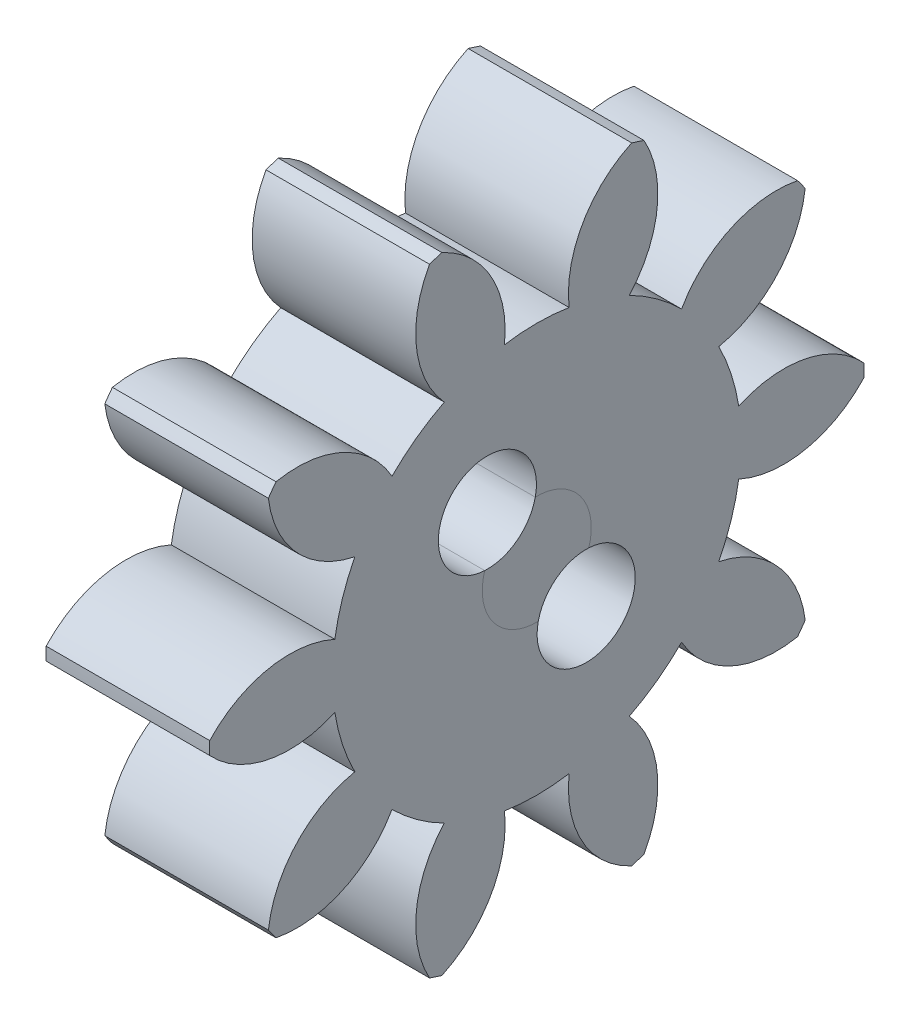
from build123d import *

# Parameters (mm, degrees)
BASPROSKE_W         = 3
BASPROSKE_H         = 6
TOOTHCUT_DEPTH      = 10
TEETHCUTS_COUNT     = 10
TEETHCUTS_ANGLE     = 324
HUBNEABOTSKE_R      = 0.5
HUBNEARBOTH_DEPTH   = 23.5000254
HUBFAR_START        = 23.5000254
HUBFARSKE_R         = 0.5
HUBFAR_DEPTH        = 23.5000254
BORSKE_R            = 1
BORE_DEPTH          = 50.0000508
SKETCH1_R           = 1
BOSS_EXTRUDE1_DEPTH = 3
SKETCH2_R           = 0.9
CUT_EXTRUDE1_DEPTH  = 3


with BuildPart() as part:
    # BasProSke → Base-Revolve (revolve)
    with BuildSketch(Plane(origin=(0, 0, 0), x_dir=(1, 0, 0), z_dir=(0, 1, 0))):
        with Locations((1.5, 3)):
            Rectangle(BASPROSKE_W, BASPROSKE_H)
    revolve(axis=Axis((-10, 0, 0), (1, 0, 0)))

    # TooCutSke → ToothCut (cut, through all)
    with BuildSketch(Plane(origin=(0, 0, 0), x_dir=(0, 0, -1), z_dir=(1, 0, 0))):
        with BuildLine():
            ThreePointArc((0.59278292, 3.701838653), (0, 3.749), (-0.59278292, 3.701838653))
            ThreePointArc((-0.59278292, 3.701838653), (-0.846593509, 4.924114224), (-1.775771316, 5.757784417))
            ThreePointArc((-1.775771316, 5.757784417), (0, 6.0254), (1.775771316, 5.757784417))
            ThreePointArc((1.775771316, 5.757784417), (0.846593509, 4.924114224), (0.59278292, 3.701838653))
        make_face()
    toothcut = extrude(amount=TOOTHCUT_DEPTH, mode=Mode.SUBTRACT)

    # TeethCuts: ToothCut ×10 about axis
    teethcuts_axis = Axis((-10, 0, 0), (1, 0, 0))
    for i in range(1, TEETHCUTS_COUNT):
        add(toothcut.rotate(teethcuts_axis, i * TEETHCUTS_ANGLE / (TEETHCUTS_COUNT - 1)), mode=Mode.SUBTRACT)

    # HubNeaBotSke → HubNearBoth (add)
    with BuildSketch(Plane.ZY):
        Circle(HUBNEABOTSKE_R)
    extrude(amount=HUBNEARBOTH_DEPTH)

    # HubFarSke → HubFar (add)
    with BuildSketch(Plane(origin=(3, 0, 0), x_dir=(0, 0, -1), z_dir=(1, 0, 0)).offset(HUBFAR_START)):
        Circle(HUBFARSKE_R)
    extrude(amount=-HUBFAR_DEPTH)

    # BorSke → Bore (cut, symmetric)
    with BuildSketch(Plane(origin=(0, 0, 0), x_dir=(0, 0, -1), z_dir=(1, 0, 0))):
        Circle(BORSKE_R)
    extrude(amount=BORE_DEPTH, both=True, mode=Mode.SUBTRACT)


with BuildPart() as body_2:
    # Sketch1 → Boss-Extrude1 (new body)
    with BuildSketch(Plane(origin=(3, 0, 0), x_dir=(0, 0, -1), z_dir=(1, 0, 0))):
        Circle(SKETCH1_R)
    extrude(amount=-BOSS_EXTRUDE1_DEPTH)


with BuildPart() as cut_extrude1_tool:
    # Sketch2 → Cut-Extrude1 (new body)
    with BuildSketch(Plane(origin=(3, 0, 0), x_dir=(0, 0, -1), z_dir=(1, 0, 0))):
        with Locations((-0.905966344, 1.19550198)):
            Circle(SKETCH2_R)
        with Locations((0.905966344, -1.19550198)):
            Circle(SKETCH2_R)
    extrude(amount=-CUT_EXTRUDE1_DEPTH)


with BuildPart() as part_1:
    add(part.part)

    # Cut-Extrude1: cut by cut_extrude1_tool
    add(cut_extrude1_tool.part, mode=Mode.SUBTRACT)


with BuildPart() as body_2_1:
    add(body_2.part)

    # Cut-Extrude1: cut by cut_extrude1_tool
    add(cut_extrude1_tool.part, mode=Mode.SUBTRACT)


solid = Compound([part_1.part, body_2_1.part])
